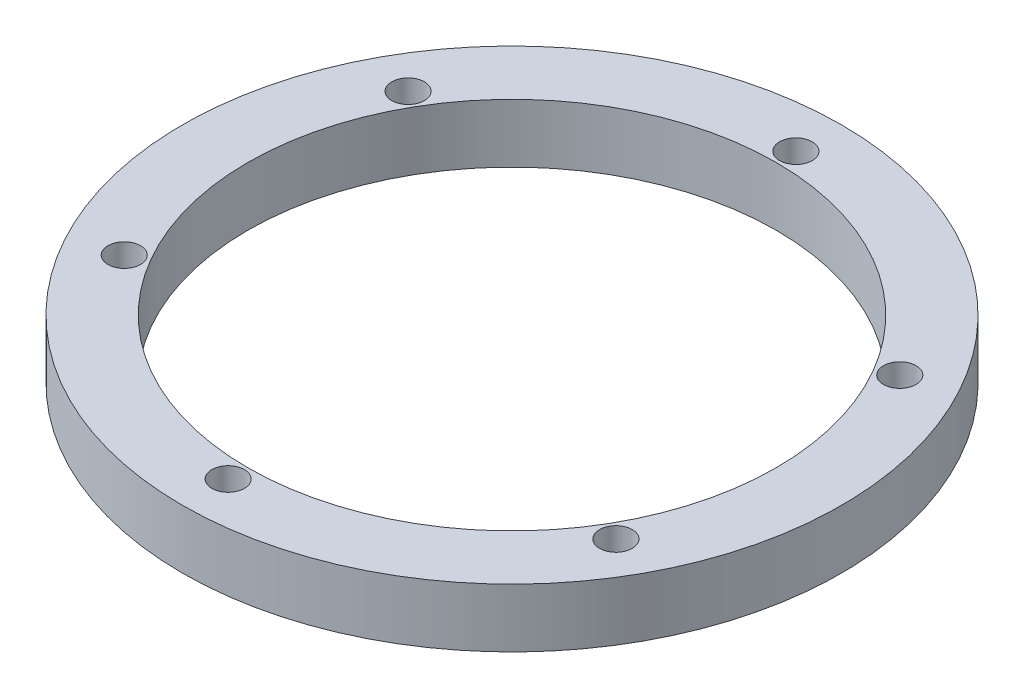
from build123d import *

# Parameters (mm, degrees)
SKETCH1_R           = 50.5
SKETCH1_R_2         = 40.5
BOSS_EXTRUDE1_DEPTH = 9
SKETCH2_R           = 2.5
CUT_EXTRUDE1_DEPTH  = 9


with BuildPart() as part:
    # Sketch1 → Boss-Extrude1 (new body)
    with BuildSketch(Plane(origin=(0, 0, 0), x_dir=(1, 0, 0), z_dir=(0, 1, 0))):
        with Locations(Location((0, 0, 0), (0, 0, 270))):
            Circle(SKETCH1_R)
        with Locations(Location((0, 0, 0), (0, 0, 270))):
            Circle(SKETCH1_R_2, mode=Mode.SUBTRACT)
    extrude(amount=BOSS_EXTRUDE1_DEPTH)

    # Sketch2 → Cut-Extrude1 (cut)
    with BuildSketch(Plane(origin=(0, 9, 0), x_dir=(1, 0, 0), z_dir=(0, 1, 0))):
        with Locations(Location((0, 43.5, 0), (0, 0, 270))):
            Circle(SKETCH2_R)
        with Locations(Location((37.672105065, 21.75, 0), (0, 0, 270))):
            Circle(SKETCH2_R)
        with Locations(Location((37.672105065, -21.75, 0), (0, 0, 270))):
            Circle(SKETCH2_R)
        with Locations(Location((0, -43.5, 0), (0, 0, 270))):
            Circle(SKETCH2_R)
        with Locations(Location((-37.672105065, -21.75, 0), (0, 0, 270))):
            Circle(SKETCH2_R)
        with Locations(Location((-37.672105065, 21.75, 0), (0, 0, 270))):
            Circle(SKETCH2_R)
    extrude(amount=-CUT_EXTRUDE1_DEPTH, mode=Mode.SUBTRACT)


solid = part.part
